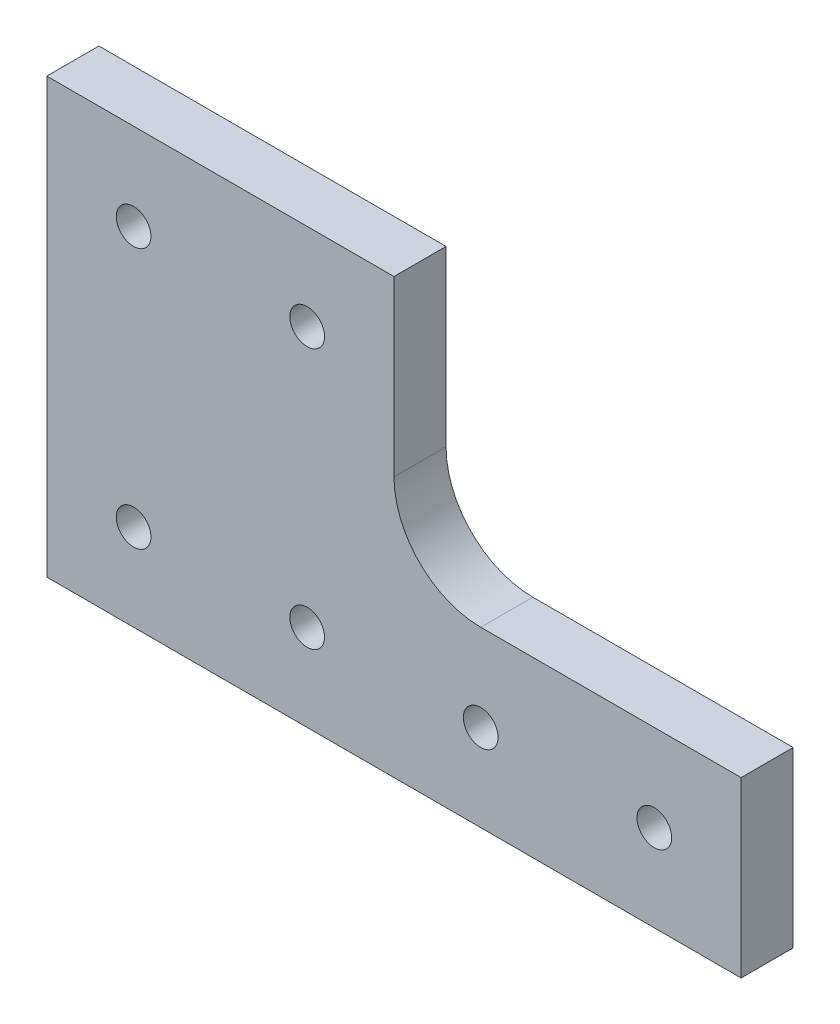
from build123d import *

# Parameters (mm, degrees)
ESBO_O1_W                = 40
ESBO_O1_H                = 50
ESBO_O1_R                = 2
ESBO_O1_H_2              = 20
RESSALTO_EXTRUS_O1_DEPTH = 6
FILETE1_R                = 10


with BuildPart() as part:
    # Esboço1 → Ressalto-extrusão1 (new body)
    # profile 1 of 2: a face of its own
    with BuildSketch(Plane.XY):
        with Locations((20, 25)):
            Rectangle(ESBO_O1_W, ESBO_O1_H)
        with Locations((30, 10)):
            Circle(ESBO_O1_R, mode=Mode.SUBTRACT)
        with Locations((10, 10)):
            Circle(ESBO_O1_R, mode=Mode.SUBTRACT)
        with Locations((30, 40)):
            Circle(ESBO_O1_R, mode=Mode.SUBTRACT)
        with Locations((10, 40)):
            Circle(ESBO_O1_R, mode=Mode.SUBTRACT)
    # profile 2 of 2: a face of its own
    with BuildSketch(Plane.XY):
        with Locations((60, 10)):
            Rectangle(ESBO_O1_W, ESBO_O1_H_2)
        with Locations((50, 10)):
            Circle(ESBO_O1_R, mode=Mode.SUBTRACT)
        with Locations((70, 10)):
            Circle(ESBO_O1_R, mode=Mode.SUBTRACT)
    extrude(amount=RESSALTO_EXTRUS_O1_DEPTH)

    # Filete1
    filete1_edges = [part.edges().sort_by_distance(p)[0] for p in [
        (40, 20, 3),
    ]]
    fillet(filete1_edges, radius=FILETE1_R)


solid = part.part
